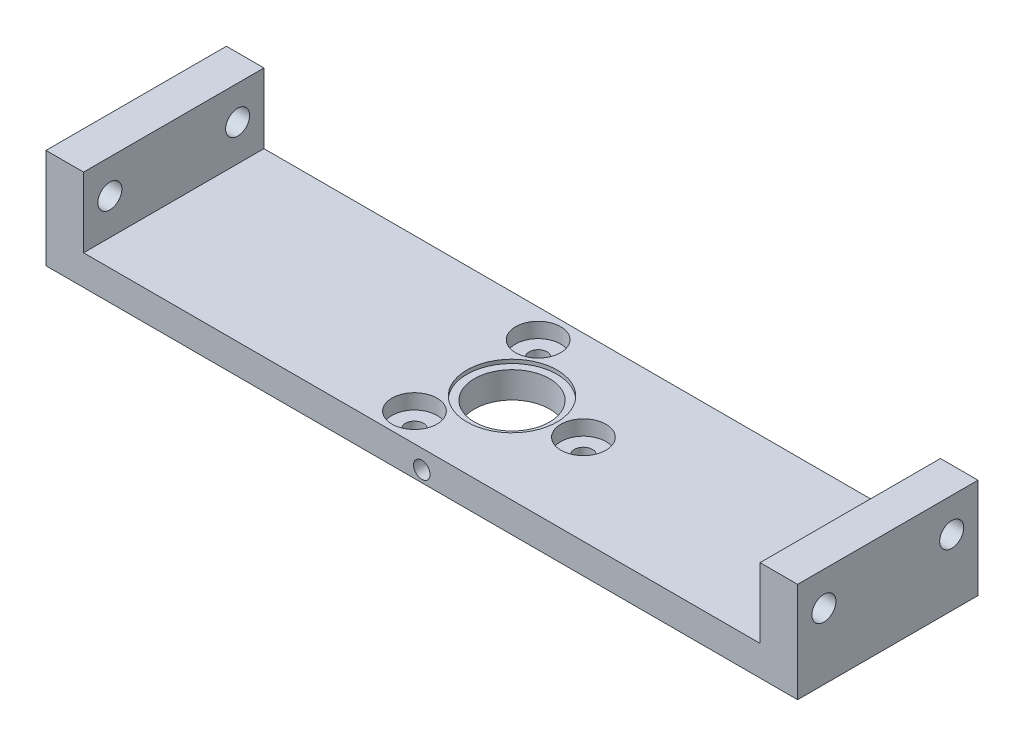
from build123d import *

# Parameters (mm, degrees)
SKETCH_1_W                   = 100
SKETCH_1_H                   = 24
EXTRUDE_1_DEPTH              = 13.3
SKETCH_2_W                   = 90
SKETCH_2_H                   = 24
CUT_EXTRUDE_1_DEPTH          = 9.3
HOLE_WIZARD_3_2_3_2_1_D      = 3.2
SKETCH_5_R                   = 5
CUT_EXTRUDE_2_DEPTH          = 53.254090749
SKETCH_6_R                   = 6
CUT_EXTRUDE_3_DEPTH          = 0.5
HOLE_WIZARD_M2_1_D           = 2.4
HOLE_WIZARD_M2_1_CBORE_D     = 6
HOLE_WIZARD_M2_1_CBORE_DEPTH = 2
PATTERN_CIRCULAR_1_COUNT     = 3
SKETCH_9_R                   = 1.1
CUT_EXTRUDE_4_DEPTH          = 10


with BuildPart() as part:
    # 草图1 → 凸台-拉伸1 (new body)
    with BuildSketch(Plane(origin=(0, 0, 0), x_dir=(1, 0, 0), z_dir=(0, 1, 0))):
        Rectangle(SKETCH_1_W, SKETCH_1_H)
    extrude(amount=EXTRUDE_1_DEPTH)

    # 草图2 → 切除-拉伸1 (cut)
    with BuildSketch(Plane(origin=(0, 13.3, 0), x_dir=(1, 0, 0), z_dir=(0, 1, 0))):
        Rectangle(SKETCH_2_W, SKETCH_2_H)
    extrude(amount=-CUT_EXTRUDE_1_DEPTH, mode=Mode.SUBTRACT)

    # Ø3.2 (3.2) 直径孔1 (through all)
    with Locations(Plane(origin=(50, 0, 0), x_dir=(0, 0, -1), z_dir=(1, 0, 0))):
        with Locations((8.5, 8.8), (-8.5, 8.8)):
            Hole(HOLE_WIZARD_3_2_3_2_1_D / 2)

    # 草图5 → 切除-拉伸2 (cut, through all)
    with BuildSketch(Plane(origin=(0, 4, 0), x_dir=(1, 0, 0), z_dir=(0, 1, 0))):
        with Locations(Location((0, 0, 0), (0, 0, 270))):
            Circle(SKETCH_5_R)
    extrude(amount=-CUT_EXTRUDE_2_DEPTH, mode=Mode.SUBTRACT)

    # 草图6 → 切除-拉伸3 (cut)
    with BuildSketch(Plane(origin=(0, 4, 0), x_dir=(1, 0, 0), z_dir=(0, 1, 0))):
        with Locations(Location((0, 0, 0), (0, 0, 270))):
            Circle(SKETCH_6_R)
    extrude(amount=-CUT_EXTRUDE_3_DEPTH, mode=Mode.SUBTRACT)

    # M2 六角头螺栓的柱形沉头孔1 (through all)
    with Locations(Plane(origin=(0, 4, 0), x_dir=(1, 0, 0), z_dir=(0, 1, 0))):
        with Locations((9.5, 0)):
            hole_wizard_m2_1 = CounterBoreHole(HOLE_WIZARD_M2_1_D / 2, HOLE_WIZARD_M2_1_CBORE_D / 2, HOLE_WIZARD_M2_1_CBORE_DEPTH)

    # 阵列(圆周)1: M2 六角头螺栓的柱形沉头孔1 ×3 about axis
    pattern_circular_1_axis = Axis((0, 0, 0), (0, 1, 0))
    for i in range(1, PATTERN_CIRCULAR_1_COUNT):
        add(hole_wizard_m2_1.rotate(pattern_circular_1_axis, i * 360 / PATTERN_CIRCULAR_1_COUNT), mode=Mode.SUBTRACT)

    # 草图9 → 切除-拉伸4 (cut)
    with BuildSketch(Plane.XY.offset(12)):
        with Locations((0, 1.5)):
            Circle(SKETCH_9_R)
    extrude(amount=-CUT_EXTRUDE_4_DEPTH, mode=Mode.SUBTRACT)


solid = part.part
